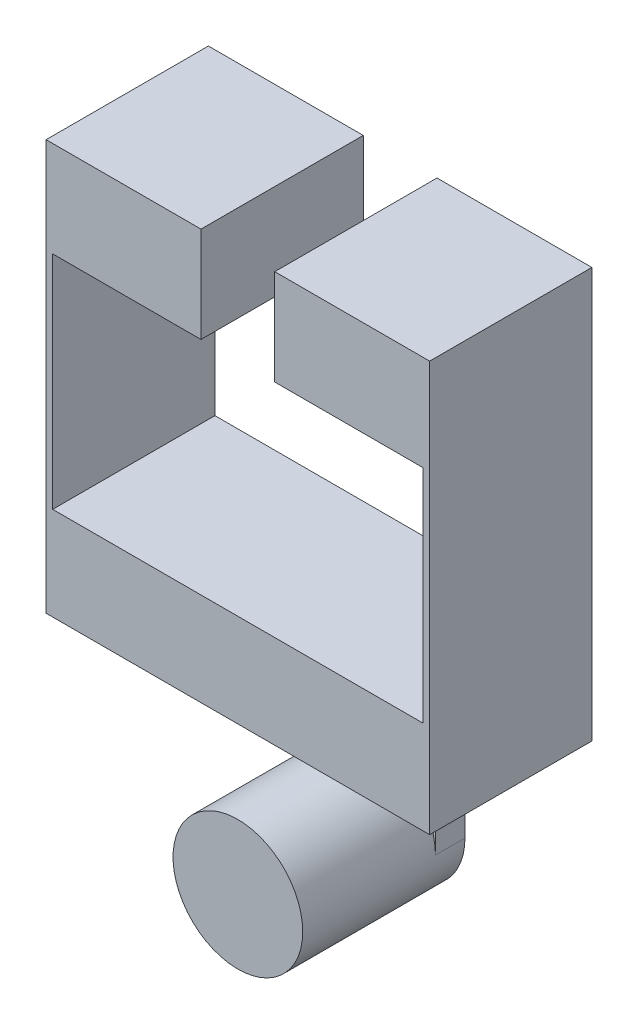
from build123d import *

# Parameters (mm, degrees)
SKETCH1_R           = 11.162804955
BOSS_EXTRUDE1_DEPTH = 25.4
BOSS_EXTRUDE2_START = -2.54
BOSS_EXTRUDE2_DEPTH = 2.54
SKETCH4_W           = 66.04
SKETCH4_H           = 25.4
BOSS_EXTRUDE3_DEPTH = 16.064370514
SKETCH5_W           = 1.129641984
SKETCH5_H           = 25.4
BOSS_EXTRUDE4_DEPTH = 38.1
SKETCH6_W           = 26.67
SKETCH6_H           = 25.4
BOSS_EXTRUDE5_DEPTH = 16.461081374
BOSS_EXTRUDE8_DEPTH = 2.54


with BuildPart() as part:
    # Sketch1 → Boss-Extrude1 (new body)
    with BuildSketch(Plane.XY):
        Circle(SKETCH1_R)
    extrude(amount=-BOSS_EXTRUDE1_DEPTH)

    # Sketch2 → Boss-Extrude2 (add)
    with BuildSketch(Plane(origin=(0, 0, -25.4), x_dir=(-1, 0, 0), z_dir=(0, 0, -1)).offset(BOSS_EXTRUDE2_START)):
        with BuildLine():
            Line((-11.162804955, 0), (-11.162804955, 25.4))
            Line((-11.162804955, 25.4), (11.162804955, 25.4))
            Line((11.162804955, 25.4), (11.162804955, 0))
            ThreePointArc((11.162804955, 0), (0, 11.162804955), (-11.162804955, 0))
        make_face()
    extrude(amount=BOSS_EXTRUDE2_DEPTH)

    # Sketch4 → Boss-Extrude3 (add)
    with BuildSketch(Plane(origin=(0, 25.4, 0), x_dir=(1, 0, 0), z_dir=(0, 1, 0))):
        with Locations((0, 12.7)):
            Rectangle(SKETCH4_W, SKETCH4_H)
    extrude(amount=BOSS_EXTRUDE3_DEPTH)

    # Sketch5 → Boss-Extrude4 (add)
    with BuildSketch(Plane(origin=(0, 41.464370514, 0), x_dir=(1, 0, 0), z_dir=(0, 1, 0))):
        with Locations((-32.455179008, 12.7)):
            Rectangle(SKETCH5_W, SKETCH5_H)
        with Locations((32.455179008, 12.7)):
            Rectangle(SKETCH5_W, SKETCH5_H)
    extrude(amount=BOSS_EXTRUDE4_DEPTH)

    # Sketch6 → Boss-Extrude5 (add)
    with BuildSketch(Plane(origin=(0, 79.564370514, 0), x_dir=(1, 0, 0), z_dir=(0, 1, 0))):
        with Locations((19.685, 12.7)):
            Rectangle(SKETCH6_W, SKETCH6_H)
        with Locations((-19.685, 12.7)):
            Rectangle(SKETCH6_W, SKETCH6_H)
    extrude(amount=BOSS_EXTRUDE5_DEPTH)

    # Sketch10 → Boss-Extrude8 (add)
    with BuildSketch(Plane(origin=(0, 0, -25.4), x_dir=(-1, 0, 0), z_dir=(0, 0, -1))):
        with BuildLine():
            Line((11.162804955, 0), (11.162804955, 25.4))
            Line((11.162804955, 25.4), (33.02, 25.4))
            Line((33.02, 25.4), (33.02, 96.025451888))
            Line((33.02, 96.025451888), (6.35, 96.025451888))
            Line((6.35, 96.025451888), (6.35, 79.564370514))
            Line((6.35, 79.564370514), (31.890358016, 79.564370514))
            Line((31.890358016, 79.564370514), (31.890358016, 41.464370514))
            Line((31.890358016, 41.464370514), (-31.890358016, 41.464370514))
            Line((-31.890358016, 41.464370514), (-31.890358016, 79.564370514))
            Line((-31.890358016, 79.564370514), (-6.35, 79.564370514))
            Line((-6.35, 79.564370514), (-6.35, 96.025451888))
            Line((-6.35, 96.025451888), (-33.02, 96.025451888))
            Line((-33.02, 96.025451888), (-33.02, 25.4))
            Line((-33.02, 25.4), (-11.162804955, 25.4))
            Line((-11.162804955, 25.4), (-11.162804955, 0))
            ThreePointArc((-11.162804955, 0), (0, -11.162804955), (11.162804955, 0))
        make_face()
    extrude(amount=BOSS_EXTRUDE8_DEPTH)


solid = part.part
